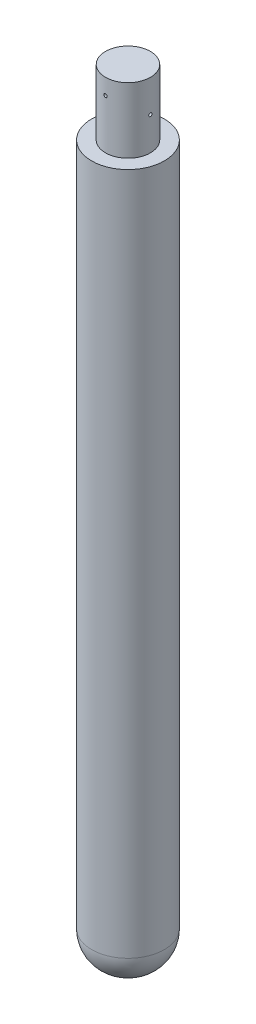
from build123d import *

# Parameters (mm, degrees)
SKETCH1_R           = 11
BOSS_EXTRUDE1_DEPTH = 216.66667
BOSS_EXTRUDE2_START = 216.66667
SKETCH2_R           = 6.8
BOSS_EXTRUDE2_DEPTH = 19.8
FILLET1_R           = 10
CUT_EXTRUDE1_START  = -1.44
SKETCH3_R           = 0.5
CUT_EXTRUDE1_DEPTH  = 9
CUT_EXTRUDE2_START  = -1.4
SKETCH4_R           = 0.5
CUT_EXTRUDE2_DEPTH  = 9


with BuildPart() as part:
    # Sketch1 → Boss-Extrude1 (new body)
    with BuildSketch(Plane(origin=(0, 0, 0), x_dir=(1, 0, 0), z_dir=(0, 1, 0))):
        with Locations(Location((0, 0, 0), (0, 0, 270))):
            Circle(SKETCH1_R)
    extrude(amount=BOSS_EXTRUDE1_DEPTH)

    # Sketch2 → Boss-Extrude2 (add)
    with BuildSketch(Plane(origin=(0, 0, 0), x_dir=(1, 0, 0), z_dir=(0, 1, 0)).offset(BOSS_EXTRUDE2_START)):
        with Locations(Location((0, 0, 0), (0, 0, 90))):
            Circle(SKETCH2_R)
    extrude(amount=BOSS_EXTRUDE2_DEPTH)

    # Fillet1
    fillet1_edges = [part.edges().sort_by_distance(p)[0] for p in [
        (0, 0, -11),
    ]]
    fillet(fillet1_edges, radius=FILLET1_R)

    # Sketch3 → Cut-Extrude1 (cut)
    with BuildSketch(Plane.XY.offset(CUT_EXTRUDE1_START)):
        with Locations((0, 231.66667)):
            Circle(SKETCH3_R)
    cut_extrude1 = extrude(amount=-CUT_EXTRUDE1_DEPTH, mode=Mode.SUBTRACT)

    # Mirror1: Cut-Extrude1 across plane
    add(cut_extrude1.mirror(Plane.XY), mode=Mode.SUBTRACT)

    # Sketch4 → Cut-Extrude2 (cut)
    with BuildSketch(Plane(origin=(0, 0, 0), x_dir=(0, 0, -1), z_dir=(1, 0, 0)).offset(CUT_EXTRUDE2_START)):
        with Locations((0, 226.66667)):
            Circle(SKETCH4_R)
    cut_extrude2 = extrude(amount=-CUT_EXTRUDE2_DEPTH, mode=Mode.SUBTRACT)

    # Mirror2: Cut-Extrude2 across plane
    add(cut_extrude2.mirror(Plane(origin=(0, 0, 0), x_dir=(0, 0, 1), z_dir=(1, 0, 0))), mode=Mode.SUBTRACT)


solid = part.part
